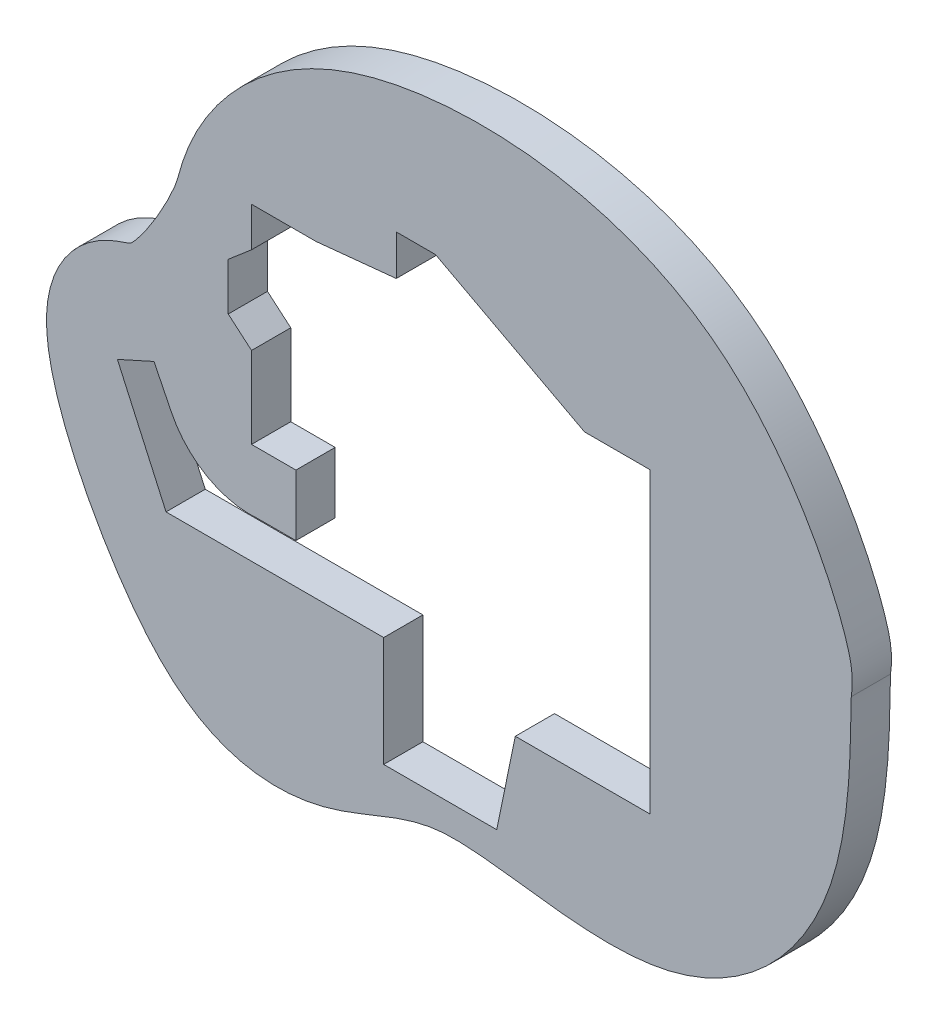
from build123d import *

# Parameters (mm, degrees)
BOSS_EXTRUDE1_DEPTH = 3


with BuildPart() as part:
    # Sketch1 → Boss-Extrude1 (new body)
    with BuildSketch(Plane.XY.offset(3)):
        with BuildLine():
            add(Edge.make_bspline(
                [(-12.503721614, 103.020909641), (-12.504258768, 103.016763491), (-12.504984744, 103.010891104), (-12.505475717, 103.006531994), (-12.505681311, 103.004529507), (-12.505859765, 103.002606145), (-12.506031709, 103.000677158), (-12.506948745, 102.989205376), (-12.508679121, 102.963442895), (-12.51078053, 102.926980906), (-12.513828389, 102.865682561), (-12.517784217, 102.76763725), (-12.522260997, 102.621221598), (-12.526331396, 102.449810535), (-12.53125847, 102.191627647), (-12.536774791, 101.818833796), (-12.543915654, 101.303798708), (-12.553470408, 100.729803932), (-12.567447812, 100.103839437), (-12.587928434, 99.431815552), (-12.626760203, 98.481338167), (-12.702359786, 97.203253421), (-12.829366588, 95.833971221), (-12.972043834, 94.69904508), (-13.102452735, 93.831571475), (-13.259346107, 92.951140362), (-13.415016976, 92.20925412), (-13.556452466, 91.612304752), (-13.671515395, 91.1632445), (-13.775381231, 90.788153898), (-13.863536759, 90.48784121), (-13.955295022, 90.187067219), (-14.075920693, 89.813545836), (-14.281218362, 89.222231936), (-14.560963384, 88.494915548), (-14.933387594, 87.642466836), (-15.478669461, 86.534720506), (-16.251123303, 85.207620917), (-17.321833668, 83.719361814), (-18.534228529, 82.349043642), (-19.885026241, 81.111990078), (-21.121601637, 80.20620566), (-22.173207635, 79.565506379), (-22.99166794, 79.129165303), (-23.838289096, 78.739169238), (-24.711248674, 78.397574527), (-25.458924014, 78.154845401), (-26.068167752, 77.986657032), (-26.453138508, 77.892564193), (-26.763945868, 77.823905401), (-27.074348774, 77.760122025), (-27.461120902, 77.689281084), (-27.923058653, 77.617555638), (-28.535685073, 77.538442233), (-29.294811033, 77.468335515), (-30.194091673, 77.423735573), (-31.081180257, 77.412740326), (-32.247272366, 77.435765152), (-33.672969026, 77.522842302), (-35.329485006, 77.686255945), (-36.925407239, 77.878904613), (-38.450734193, 78.073969292), (-39.891373306, 78.247000647), (-41.005914863, 78.354513531), (-41.834209512, 78.409541333), (-42.420328861, 78.433690639), (-42.876499624, 78.438540996), (-43.220198532, 78.433015243), (-43.425741075, 78.425663409), (-43.58444437, 78.417473529), (-43.70039055, 78.410204058), (-43.813852366, 78.401779698), (-43.965056942, 78.388810347), (-44.152738999, 78.369484166), (-44.451220452, 78.332074383), (-44.821531873, 78.273499009), (-45.263939418, 78.185240355), (-45.706413511, 78.079867937), (-46.298780562, 77.917724069), (-47.04750345, 77.676747269), (-47.969203365, 77.335496546), (-48.764750062, 77.017760724), (-49.423919928, 76.751246021), (-49.931693323, 76.547516446), (-50.455171651, 76.342511624), (-50.906755025, 76.173087703), (-51.278764973, 76.040159497), (-51.563597853, 75.942273056), (-51.85454957, 75.846770595), (-52.152571813, 75.754169855), (-52.451342717, 75.666899826), (-52.851797737, 75.557470794), (-53.355979003, 75.434285966), (-53.967301739, 75.309655382), (-54.790977496, 75.176619664), (-55.836728898, 75.076848969), (-57.113357521, 75.078805079), (-58.400996476, 75.217322066), (-59.68201336, 75.503465531), (-60.934733351, 75.941838432), (-62.133467595, 76.526026066), (-63.260542319, 77.239170389), (-64.312648372, 78.062905702), (-65.297866506, 78.983649726), (-66.230705856, 79.994983137), (-67.127468839, 81.096686726), (-68.004332299, 82.29302995), (-68.874634064, 83.590910025), (-69.728315407, 84.974032224), (-70.55305321, 86.425465899), (-71.334167522, 87.927390637), (-72.056018911, 89.463264321), (-72.594477101, 90.759968713), (-72.978499443, 91.80353675), (-73.24065044, 92.589305382), (-73.474165507, 93.378854702), (-73.675743757, 94.174016105), (-73.841181852, 94.978069078), (-73.944202981, 95.659773306), (-74.001499472, 96.215831974), (-74.03044198, 96.639352436), (-74.041410425, 96.998809624), (-74.041194714, 97.290738206), (-74.037858324, 97.438628781), (-74.035335412, 97.512714358)],
                knots=[0.5, 0.5, 0.5, 0.5, 0.500976562, 0.501953125, 0.502929688, 0.503417969, 0.50390625, 0.504882812, 0.505859375, 0.506835938, 0.5078125, 0.509765625, 0.51171875, 0.513671875, 0.515625, 0.51953125, 0.5234375, 0.52734375, 0.53125, 0.53515625, 0.5390625, 0.546875, 0.5546875, 0.55859375, 0.5625, 0.56640625, 0.5703125, 0.572265625, 0.57421875, 0.576171875, 0.577148438, 0.578125, 0.580078125, 0.58203125, 0.5859375, 0.58984375, 0.59375, 0.6015625, 0.609375, 0.6171875, 0.625, 0.6328125, 0.63671875, 0.640625, 0.64453125, 0.6484375, 0.65234375, 0.654296875, 0.65625, 0.657226562, 0.658203125, 0.66015625, 0.662109375, 0.6640625, 0.66796875, 0.671875, 0.67578125, 0.6796875, 0.6875, 0.6953125, 0.703125, 0.7109375, 0.71875, 0.7265625, 0.73046875, 0.734375, 0.73828125, 0.740234375, 0.7421875, 0.743164062, 0.744140625, 0.745117188, 0.74609375, 0.748046875, 0.75, 0.75390625, 0.7578125, 0.76171875, 0.765625, 0.7734375, 0.78125, 0.7890625, 0.79296875, 0.796875, 0.80078125, 0.8046875, 0.806640625, 0.80859375, 0.810546875, 0.8125, 0.814453125, 0.81640625, 0.8203125, 0.82421875, 0.828125, 0.8359375, 0.84375, 0.8515625, 0.859375, 0.8671875, 0.875, 0.8828125, 0.890625, 0.8984375, 0.90625, 0.9140625, 0.921875, 0.9296875, 0.9375, 0.9453125, 0.953125, 0.9609375, 0.96875, 0.97265625, 0.9765625, 0.98046875, 0.984375, 0.98828125, 0.9921875, 0.994140625, 0.99609375, 0.998046875, 0.999023438, 1, 1, 1, 1], degree=3))
            add(Edge.make_bspline(
                [(-74.035335412, 97.512714358), (-74.032812501, 97.586799935), (-74.026057243, 97.735251667), (-74.005765747, 98.030190729), (-73.967579358, 98.396253122), (-73.901148162, 98.829894265), (-73.785171491, 99.399169874), (-73.58927076, 100.090860938), (-73.2767092, 100.878471107), (-72.893898096, 101.613547927), (-72.450561521, 102.287904807), (-71.957818995, 102.89614661), (-71.515401448, 103.345933052), (-71.147480703, 103.67167958), (-70.865645819, 103.899203934), (-70.578921709, 104.110256523), (-70.336620916, 104.272741173), (-70.141140842, 104.39490332), (-69.993737151, 104.482694059), (-69.845807189, 104.566612628), (-69.696662146, 104.647088719), (-69.55057693, 104.722039621), (-69.360732258, 104.814825075), (-69.133836081, 104.917963369), (-68.881572329, 105.023263673), (-68.575151818, 105.142093782), (-68.252816494, 105.256029303), (-67.967942246, 105.353037361), (-67.779647416, 105.420228841), (-67.674480007, 105.462566392), (-67.638616077, 105.47975178), (-67.627573183, 105.48563123), (-67.624480266, 105.487449108), (-67.623036343, 105.488354743), (-67.620422396, 105.490105655), (-67.615981467, 105.493354621), (-67.611997521, 105.496402783), (-67.607838514, 105.499704769), (-67.603322674, 105.503364015), (-67.593874827, 105.511238088), (-67.576565854, 105.526289584), (-67.546498458, 105.553458321), (-67.477243979, 105.619154647), (-67.340076871, 105.761157947), (-67.135034807, 105.996662811), (-66.903283062, 106.286083861), (-66.654683198, 106.619298978), (-66.396623637, 106.98708303), (-66.047684499, 107.512218614), (-65.61476986, 108.213638), (-65.212831183, 108.924667011), (-64.923627254, 109.469294307), (-64.726312768, 109.857659939), (-64.581154479, 110.15736348), (-64.47854882, 110.37766288), (-64.408854391, 110.531745682), (-64.347179258, 110.672577598), (-64.275630116, 110.842005922), (-64.201293922, 111.029039534), (-64.130338937, 111.223049473), (-64.070333848, 111.401483285), (-64.014521741, 111.58091339), (-63.956716265, 111.778645854), (-63.891532854, 112.009412873), (-63.814172236, 112.282553268), (-63.736110549, 112.547163538), (-63.672680539, 112.750715673), (-63.633989948, 112.871144856), (-63.574267997, 113.053362356), (-63.477585424, 113.334512649), (-63.332706852, 113.724242022), (-63.170828903, 114.127787167), (-62.931067372, 114.682673617), (-62.584159332, 115.405028997), (-62.168412762, 116.158400279), (-61.791289084, 116.77546821), (-61.48540621, 117.244437195), (-61.155874102, 117.718518035), (-60.680941325, 118.359739156), (-60.018994898, 119.172686661), (-59.108392499, 120.151789539), (-58.075619668, 121.118429124), (-56.915815734, 122.056099979), (-55.62547873, 122.947982097), (-54.439674888, 123.639171971), (-53.424334311, 124.152904912), (-52.629496085, 124.516704458), (-51.801349567, 124.857172431), (-51.083584806, 125.120009344), (-50.492719158, 125.316908248), (-49.894414859, 125.503687928), (-49.131987838, 125.718861694), (-48.195142053, 125.948286179), (-46.918249992, 126.216230299), (-45.27329538, 126.480201081), (-43.23254948, 126.681763918), (-40.439286068, 126.791544729), (-37.564081602, 126.652518617), (-34.663862983, 126.234672155), (-32.491394015, 125.772062308), (-30.337501692, 125.149371262), (-28.572417198, 124.486681758), (-27.187956934, 123.863368065), (-26.166155554, 123.3474861), (-25.163810913, 122.781385005), (-24.347432541, 122.266317309), (-23.707355576, 121.827371838), (-23.313270347, 121.541781489), (-23.001468351, 121.306178574), (-22.693972702, 121.067327277), (-22.317707831, 120.763072776), (-21.878883849, 120.389653149), (-21.310391443, 119.881748176), (-20.358251435, 118.969289557), (-19.115152603, 117.612859008), (-17.79663054, 115.942278436), (-16.639901882, 114.266846375), (-15.63611601, 112.622589857), (-14.778418335, 111.044036992), (-14.180799265, 109.810766049), (-13.770424317, 108.888110254), (-13.495802515, 108.231039874), (-13.253525642, 107.611084815), (-13.042553067, 107.028975725), (-12.861445532, 106.482527465), (-12.733646502, 106.050647011), (-12.643708791, 105.707871625), (-12.592229442, 105.48970748), (-12.553737461, 105.307773124), (-12.517085645, 105.118122729), (-12.476085538, 104.867109444), (-12.438745437, 104.540374599), (-12.418905984, 104.196053693), (-12.419866427, 103.855688972), (-12.438250832, 103.550857375), (-12.463879157, 103.310352107), (-12.485915645, 103.147216093), (-12.499105354, 103.055466201), (-12.502647305, 103.029201942), (-12.503721614, 103.020909641)],
                knots=[0, 0, 0, 0, 0.000976562, 0.001953125, 0.00390625, 0.005859375, 0.0078125, 0.01171875, 0.015625, 0.01953125, 0.0234375, 0.02734375, 0.03125, 0.033203125, 0.03515625, 0.037109375, 0.0390625, 0.040039062, 0.041015625, 0.041992188, 0.04296875, 0.043945312, 0.044921875, 0.046875, 0.048828125, 0.05078125, 0.0546875, 0.05859375, 0.0625, 0.06640625, 0.0703125, 0.072265625, 0.07421875, 0.076171875, 0.078125, 0.079101562, 0.080078125, 0.080566406, 0.081054688, 0.08203125, 0.083007812, 0.083984375, 0.0859375, 0.08984375, 0.09375, 0.09765625, 0.1015625, 0.10546875, 0.109375, 0.1171875, 0.125, 0.12890625, 0.1328125, 0.13671875, 0.138671875, 0.140625, 0.142578125, 0.14453125, 0.1484375, 0.15234375, 0.15625, 0.16015625, 0.1640625, 0.16796875, 0.171875, 0.17578125, 0.177734375, 0.178710938, 0.1796875, 0.18359375, 0.1875, 0.19140625, 0.1953125, 0.203125, 0.2109375, 0.21484375, 0.21875, 0.22265625, 0.2265625, 0.234375, 0.2421875, 0.25, 0.2578125, 0.265625, 0.2734375, 0.27734375, 0.28125, 0.28515625, 0.2890625, 0.291015625, 0.29296875, 0.296875, 0.30078125, 0.3046875, 0.3125, 0.3203125, 0.328125, 0.34375, 0.3515625, 0.359375, 0.3671875, 0.375, 0.37890625, 0.3828125, 0.38671875, 0.390625, 0.392578125, 0.39453125, 0.395507812, 0.396484375, 0.3984375, 0.400390625, 0.40234375, 0.40625, 0.4140625, 0.421875, 0.4296875, 0.4375, 0.4453125, 0.453125, 0.45703125, 0.4609375, 0.46484375, 0.46875, 0.47265625, 0.4765625, 0.478515625, 0.48046875, 0.481445312, 0.482421875, 0.484375, 0.486328125, 0.48828125, 0.490234375, 0.4921875, 0.494140625, 0.49609375, 0.498046875, 0.5, 0.5, 0.5, 0.5], degree=3))
        make_face()
        with BuildLine():
            Line((-27.902727633, 87.557333605), (-38.193320394, 87.557333605))
            Line((-38.193320394, 87.557333605), (-39.6136734, 80.659495161))
            Line((-39.6136734, 80.659495161), (-48.257478454, 80.659495161))
            Line((-48.257478454, 80.659495161), (-48.257478454, 89.060311968))
            Line((-48.257478454, 89.060311968), (-64.899137496, 89.060311968))
            Line((-64.899137496, 89.060311968), (-68.617494499, 97.300900458))
            Line((-68.617494499, 97.300900458), (-65.820836688, 98.562821517))
            Line((-65.820836688, 98.562821517), (-64.486927034, 95.865073409))
            ThreePointArc((-64.486927034, 95.865073409), (-61.73320004, 92.964892888), (-57.822382228, 92.128493786))
            Line((-57.822382228, 92.128493786), (-54.9668315, 92.128493786))
            Line((-54.9668315, 92.128493786), (-54.9668315, 96.798683831))
            Line((-54.9668315, 96.798683831), (-58.361540384, 96.798683831))
            Line((-58.361540384, 96.798683831), (-58.361540384, 103.020909641))
            Line((-58.361540384, 103.020909641), (-60.143216772, 104.541219239))
            Line((-60.143216772, 104.541219239), (-60.143216772, 108.165657039))
            Line((-60.143216772, 108.165657039), (-58.361549847, 109.685731698))
            Line((-58.361549847, 109.685731698), (-58.361549847, 112.702779494))
            Line((-58.361549847, 112.702779494), (-53.433167981, 112.702779494))
            Line((-53.433167981, 112.702779494), (-47.293727633, 113.318576054))
            Line((-47.293727633, 113.318576054), (-47.293727633, 116.403349188))
            Line((-47.293727633, 116.403349188), (-44.293727633, 116.403349188))
            Line((-44.293727633, 116.403349188), (-32.902727633, 110.357333605))
            Line((-32.902727633, 110.357333605), (-27.902727633, 110.357333605))
            Line((-27.902727633, 110.357333605), (-27.902727633, 87.557333605))
        make_face(mode=Mode.SUBTRACT)
    extrude(amount=BOSS_EXTRUDE1_DEPTH)


solid = part.part
